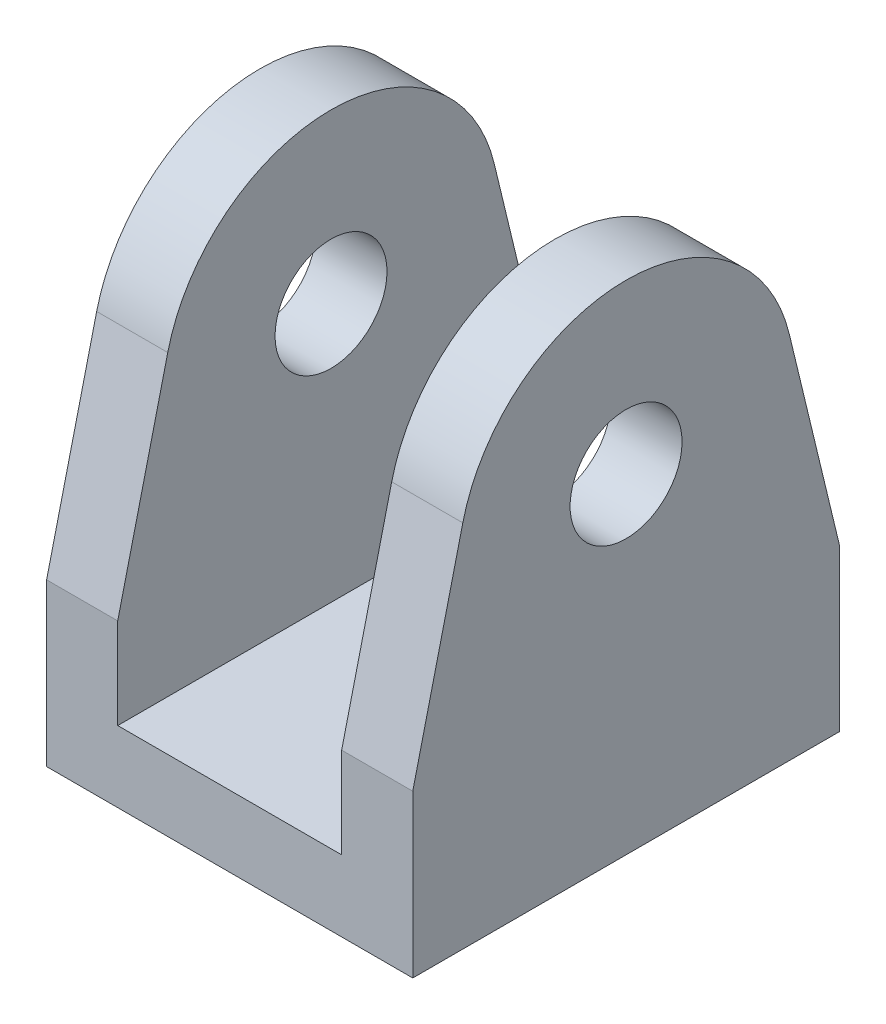
from build123d import *

# Parameters (mm, degrees)
SKETCH1_W             = 3.175
SKETCH1_H             = 19.05
SKETCH1_W_2           = 10
BOSS_EXTRUDE1_DEPTH   = 3.175
BOSS_EXTRUDE2_START   = 3.175
SKETCH1_3_W           = 3.175
SKETCH1_3_H           = 19.05
BOSS_EXTRUDE2_DEPTH   = 19.05
CUT_EXTRUDE1_DEPTH    = 30.189017626
F_5_0MM_DOWEL_HOLE1_D = 5


with BuildPart() as part:
    # Sketch1 → Boss-Extrude1 (new body)
    with BuildSketch(Plane(origin=(0, 0, 0), x_dir=(1, 0, 0), z_dir=(0, 1, 0))):
        with Locations((-6.5875, 0)):
            Rectangle(SKETCH1_W, SKETCH1_H)
        Rectangle(SKETCH1_W_2, SKETCH1_H)
        with Locations((6.5875, 0)):
            Rectangle(SKETCH1_W, SKETCH1_H)
    extrude(amount=BOSS_EXTRUDE1_DEPTH)

    # Sketch1<3> → Boss-Extrude2 (add)
    with BuildSketch(Plane(origin=(0, 0, 0), x_dir=(1, 0, 0), z_dir=(0, 1, 0)).offset(BOSS_EXTRUDE2_START)):
        with Locations((-6.5875, 0)):
            Rectangle(SKETCH1_3_W, SKETCH1_3_H)
        with Locations((6.5875, 0)):
            Rectangle(SKETCH1_3_W, SKETCH1_3_H)
    extrude(amount=BOSS_EXTRUDE2_DEPTH)

    # Sketch2 → Cut-Extrude1 (cut, through all)
    with BuildSketch(Plane(origin=(8.175, 0, 0), x_dir=(0, 0, -1), z_dir=(1, 0, 0))):
        with BuildLine():
            Line((-9.525, 22.225), (-9.525, 7.225))
            Line((-9.525, 7.225), (-7.290749742, 16.484252172))
            ThreePointArc((-7.290749742, 16.484252172), (-4.6398065, 20.617554255), (0, 22.225))
            Line((0, 22.225), (-9.525, 22.225))
        make_face()
        with BuildLine():
            Line((9.525, 22.225), (0, 22.225))
            ThreePointArc((0, 22.225), (4.6398065, 20.617554255), (7.290749742, 16.484252172))
            Line((7.290749742, 16.484252172), (9.525, 7.225))
            Line((9.525, 7.225), (9.525, 22.225))
        make_face()
    extrude(amount=-CUT_EXTRUDE1_DEPTH, mode=Mode.SUBTRACT)

    # Ø5.0mm Dowel Hole1 (through all)
    with Locations(Plane(origin=(8.175, 0, 0), x_dir=(0, 0, -1), z_dir=(1, 0, 0))):
        with Locations((0, 14.725)):
            Hole(F_5_0MM_DOWEL_HOLE1_D / 2)


solid = part.part
